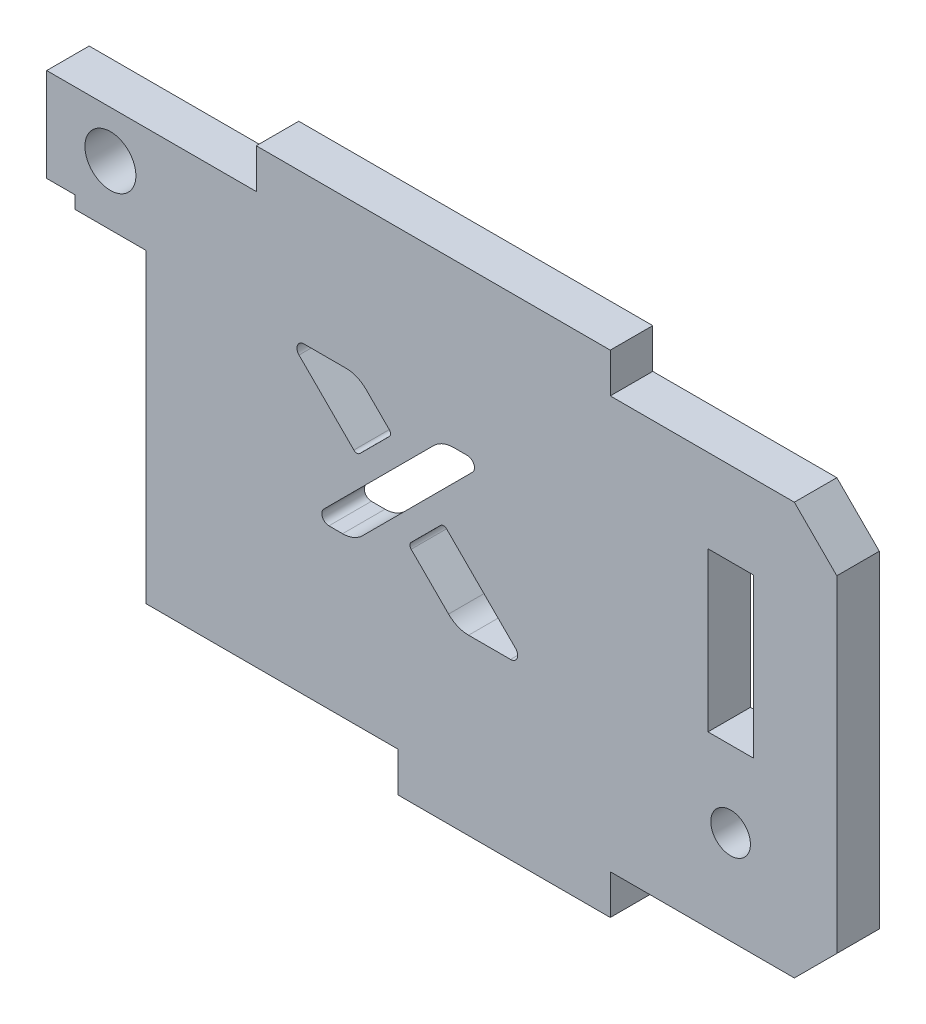
from build123d import *

# Parameters (mm, degrees)
SKETCH_1_R           = 1.8
SKETCH_1_W           = 3
SKETCH_1_H           = 12
EXTRUDE_1_DEPTH      = 3
SKETCH_3_W           = 34
SKETCH_3_H           = 3
CUT_EXTRUDE_1_DEPTH  = 10
SKETCH_4_W           = 38
SKETCH_4_H           = 2
CUT_EXTRUDE_2_DEPTH  = 10
SKETCH_5_W           = 3
SKETCH_5_H           = 2
EXTRUDE_2_DEPTH      = 2
SKETCH_6_W           = 3
SKETCH_6_H           = 2
EXTRUDE_3_DEPTH      = 2
SKETCH_7_W           = 34
SKETCH_7_H           = 3
CUT_EXTRUDE_3_DEPTH  = 2
SKETCH_8_W           = 3
SKETCH_8_H           = 10
EXTRUDE_4_DEPTH      = 5
SKETCH_9_W           = 5
SKETCH_9_H           = 3
CUT_EXTRUDE_4_DEPTH  = 2
CUT_EXTRUDE_5_DEPTH  = 10
SKETCH_11_W          = 3
SKETCH_11_H          = 8
CUT_EXTRUDE_6_DEPTH  = 5
SKETCH_12_W          = 3.2
SKETCH_12_H          = 12.2
SKETCH_12_W_2        = 3
SKETCH_12_H_2        = 12
CUT_EXTRUDE_7_DEPTH  = 10
SKETCH_13_W          = 3.2
SKETCH_13_H          = 3
EXTRUDE_5_DEPTH      = 3
SKETCH_14_W          = 3.2
SKETCH_14_H          = 3
CUT_EXTRUDE_8_DEPTH  = 3
SKETCH_15_W          = 3.2
SKETCH_15_H          = 3
EXTRUDE_6_DEPTH      = 1
SKETCH_16_R          = 1.4
CUT_EXTRUDE_9_DEPTH  = 3
SKETCH_17_W          = 5
SKETCH_17_H          = 3.106186253
CUT_EXTRUDE_10_DEPTH = 10


with BuildPart() as part:
    # 草图1 → 凸台-拉伸1 (new body)
    with BuildSketch(Plane.XY):
        Polygon((-64.8, 13.92), (-67.8, 13.92), (-70.8, 10.92), (-70.8, -12.18), (-67.8, -15.18), (-64.8, -15.18), (-54.8, -15.18), (-54.8, -17.98), (-39.8, -17.98), (-39.8, -15.18), (-22, -15.18), (-22, 3.32), (-17, 3.32), (-17, 0.32), (17, 0.32), (17, 3.32), (22, 3.32), (22, -15.18), (39.8, -15.18), (39.8, -17.98), (54.8, -17.98), (54.8, -15.18), (67.8, -15.18), (70.8, -12.18), (70.8, 10.92), (67.8, 13.92), (54.8, 13.92), (54.8, 16.72), (29.8, 16.72), (29.8, 13.92), (10, 13.92), (10, 16.72), (-10, 16.72), (-10, 13.92), (-29.8, 13.92), (-29.8, 16.72), (-54.8, 16.72), (-54.8, 13.92), align=None)
        with Locations((-19.5, 10.636938849)):
            Circle(SKETCH_1_R, mode=Mode.SUBTRACT)
        with Locations((19.5, 10.636938849)):
            Circle(SKETCH_1_R, mode=Mode.SUBTRACT)
        with BuildLine():
            Line((-48.112743691, -4.863700543), (-43.239089288, 0.009953861))
            ThreePointArc((-43.239089288, 0.009953861), (-43.026957254, 0.097821826), (-42.814825219, 0.009953861))
            Line((-42.814825219, 0.009953861), (-40.739089288, -2.065782071))
            ThreePointArc((-40.739089288, -2.065782071), (-40.651221322, -2.277914105), (-40.739089288, -2.490046139))
            Line((-40.739089288, -2.490046139), (-43.380510644, -5.131467496))
            ThreePointArc((-43.380510644, -5.131467496), (-44.029357342, -5.565012998), (-44.794724207, -5.717253933))
            Line((-44.794724207, -5.717253933), (-47.759190301, -5.717253933))
            ThreePointArc((-47.759190301, -5.717253933), (-48.221130067, -5.408595649), (-48.112743691, -4.863700543))
        make_face(mode=Mode.SUBTRACT)
        with Locations((-63.3, -0.08)):
            Rectangle(SKETCH_1_W, SKETCH_1_H, mode=Mode.SUBTRACT)
        with BuildLine():
            Line((-37.309442832, -3.374108183), (-45.06249116, 4.378940145))
            ThreePointArc((-45.06249116, 4.378940145), (-45.170877535, 4.923835251), (-44.708937769, 5.232493535))
            Line((-44.708937769, 5.232493535), (-43.744471675, 5.232493535))
            ThreePointArc((-43.744471675, 5.232493535), (-42.97910481, 5.0802526), (-42.330258113, 4.646707097))
            Line((-42.330258113, 4.646707097), (-34.577209785, -3.10634123))
            ThreePointArc((-34.577209785, -3.10634123), (-34.46882341, -3.651236336), (-34.930763176, -3.95989462))
            Line((-34.930763176, -3.95989462), (-35.89522927, -3.95989462))
            ThreePointArc((-35.89522927, -3.95989462), (-36.660596135, -3.807653685), (-37.309442832, -3.374108183))
        make_face(mode=Mode.SUBTRACT)
        with BuildLine():
            Line((-32.819850472, 5.429192676), (-36.693504876, 1.555538273))
            ThreePointArc((-36.693504876, 1.555538273), (-36.90563691, 1.467670307), (-37.117768944, 1.555538273))
            Line((-37.117768944, 1.555538273), (-39.193504876, 3.631274204))
            ThreePointArc((-39.193504876, 3.631274204), (-39.281372841, 3.843406239), (-39.193504876, 4.055538273))
            Line((-39.193504876, 4.055538273), (-37.55208352, 5.696959629))
            ThreePointArc((-37.55208352, 5.696959629), (-36.903236822, 6.130505132), (-36.137869957, 6.282746067))
            Line((-36.137869957, 6.282746067), (-33.173403863, 6.282746067))
            ThreePointArc((-33.173403863, 6.282746067), (-32.711464097, 5.974087783), (-32.819850472, 5.429192676))
        make_face(mode=Mode.SUBTRACT)
        with Locations((63.3, -0.076886306)):
            Rectangle(SKETCH_1_W, SKETCH_1_H, mode=Mode.SUBTRACT)
        with BuildLine():
            Line((42.330258113, 4.646707097), (34.577209785, -3.10634123))
            ThreePointArc((34.577209785, -3.10634123), (34.46882341, -3.651236336), (34.930763176, -3.95989462))
            Line((34.930763176, -3.95989462), (35.89522927, -3.95989462))
            ThreePointArc((35.89522927, -3.95989462), (36.660596135, -3.807653685), (37.309442832, -3.374108183))
            Line((37.309442832, -3.374108183), (45.06249116, 4.378940145))
            ThreePointArc((45.06249116, 4.378940145), (45.170877535, 4.923835251), (44.708937769, 5.232493535))
            Line((44.708937769, 5.232493535), (43.744471675, 5.232493535))
            ThreePointArc((43.744471675, 5.232493535), (42.97910481, 5.0802526), (42.330258113, 4.646707097))
        make_face(mode=Mode.SUBTRACT)
        with BuildLine():
            Line((48.112743691, -4.863700543), (43.239089288, 0.009953861))
            ThreePointArc((43.239089288, 0.009953861), (43.026957254, 0.097821826), (42.814825219, 0.009953861))
            Line((42.814825219, 0.009953861), (40.739089288, -2.065782071))
            ThreePointArc((40.739089288, -2.065782071), (40.651221322, -2.277914105), (40.739089288, -2.490046139))
            Line((40.739089288, -2.490046139), (43.380510644, -5.131467496))
            ThreePointArc((43.380510644, -5.131467496), (44.029357342, -5.565012998), (44.794724207, -5.717253933))
            Line((44.794724207, -5.717253933), (47.759190301, -5.717253933))
            ThreePointArc((47.759190301, -5.717253933), (48.221130067, -5.408595649), (48.112743691, -4.863700543))
        make_face(mode=Mode.SUBTRACT)
        with BuildLine():
            Line((39.193504876, 4.055538273), (37.55208352, 5.696959629))
            ThreePointArc((37.55208352, 5.696959629), (36.903236822, 6.130505132), (36.137869957, 6.282746067))
            Line((36.137869957, 6.282746067), (33.173403863, 6.282746067))
            ThreePointArc((33.173403863, 6.282746067), (32.711464097, 5.974087783), (32.819850472, 5.429192676))
            Line((32.819850472, 5.429192676), (36.693504876, 1.555538273))
            ThreePointArc((36.693504876, 1.555538273), (36.90563691, 1.467670307), (37.117768944, 1.555538273))
            Line((37.117768944, 1.555538273), (39.193504876, 3.631274204))
            ThreePointArc((39.193504876, 3.631274204), (39.281372841, 3.843406239), (39.193504876, 4.055538273))
        make_face(mode=Mode.SUBTRACT)
    extrude(amount=EXTRUDE_1_DEPTH)

    # 草图3 → 切除-拉伸1 (cut)
    with BuildSketch(Plane(origin=(0, 0, 0), x_dir=(-1, 0, 0), z_dir=(0, 0, -1))):
        with Locations((0, 1.82)):
            Rectangle(SKETCH_3_W, SKETCH_3_H)
    extrude(amount=-CUT_EXTRUDE_1_DEPTH, mode=Mode.SUBTRACT)

    # 草图4 → 切除-拉伸2 (cut)
    with BuildSketch(Plane(origin=(0, 0, 0), x_dir=(-1, 0, 0), z_dir=(0, 0, -1))):
        with Locations((0, 4.32)):
            Rectangle(SKETCH_4_W, SKETCH_4_H)
    extrude(amount=-CUT_EXTRUDE_2_DEPTH, mode=Mode.SUBTRACT)

    # 草图5 → 凸台-拉伸2 (add)
    with BuildSketch(Plane(origin=(-19, 0, 0), x_dir=(0, 0, -1), z_dir=(1, 0, 0))):
        with Locations((-1.5, 4.32)):
            Rectangle(SKETCH_5_W, SKETCH_5_H)
    extrude(amount=EXTRUDE_2_DEPTH)

    # 草图6 → 凸台-拉伸3 (add)
    with BuildSketch(Plane.ZY.offset(-19)):
        with Locations((1.5, 4.32)):
            Rectangle(SKETCH_6_W, SKETCH_6_H)
    extrude(amount=EXTRUDE_3_DEPTH)

    # 草图7 → 切除-拉伸3 (cut)
    with BuildSketch(Plane.XZ.offset(-5.32)):
        with Locations((0, 1.5)):
            Rectangle(SKETCH_7_W, SKETCH_7_H)
    extrude(amount=-CUT_EXTRUDE_3_DEPTH, mode=Mode.SUBTRACT)

    # 草图8 → 凸台-拉伸4 (add)
    with BuildSketch(Plane.ZY.offset(-22)):
        with Locations((1.5, -7.18)):
            Rectangle(SKETCH_8_W, SKETCH_8_H)
    extrude_4 = extrude(amount=EXTRUDE_4_DEPTH)

    # 镜向1: 凸台-拉伸4 across plane
    add(extrude_4.mirror(Plane.ZY))

    # 草图9 → 切除-拉伸4 (cut)
    with BuildSketch(Plane.XZ.offset(12.18)):
        with Locations((-19.5, 1.5)):
            Rectangle(SKETCH_9_W, SKETCH_9_H)
        with Locations((19.5, 1.5)):
            Rectangle(SKETCH_9_W, SKETCH_9_H)
    extrude(amount=-CUT_EXTRUDE_4_DEPTH, mode=Mode.SUBTRACT)

    # 草图10 → 切除-拉伸5 (cut)
    with BuildSketch(Plane(origin=(0, 0, 0), x_dir=(-1, 0, 0), z_dir=(0, 0, -1))):
        Polygon((-15, 7.32), (-15, 18.727392341), (81.723481171, 18.727392341), (81.723481171, -24.797051458), (-15, -24.797051458), align=None)
    extrude(amount=-CUT_EXTRUDE_5_DEPTH, mode=Mode.SUBTRACT)

    # 草图11 → 切除-拉伸6 (cut)
    with BuildSketch(Plane.ZY.offset(-17)):
        with Locations((1.5, -6.18)):
            Rectangle(SKETCH_11_W, SKETCH_11_H)
    extrude(amount=-CUT_EXTRUDE_6_DEPTH, mode=Mode.SUBTRACT)

    # 草图12 → 切除-拉伸7 (cut)
    with BuildSketch(Plane(origin=(0, 0, 0), x_dir=(-1, 0, 0), z_dir=(0, 0, -1))):
        with Locations((-63.3, -0.076886306)):
            Rectangle(SKETCH_12_W, SKETCH_12_H)
        with Locations((-63.3, -0.076886306)):
            Rectangle(SKETCH_12_W_2, SKETCH_12_H_2, mode=Mode.SUBTRACT)
    extrude(amount=-CUT_EXTRUDE_7_DEPTH, mode=Mode.SUBTRACT)

    # 草图13 → 凸台-拉伸5 (add)
    with BuildSketch(Plane(origin=(0, -6.176886306, 0), x_dir=(1, 0, 0), z_dir=(0, 1, 0))):
        with Locations((63.3, -1.5)):
            Rectangle(SKETCH_13_W, SKETCH_13_H)
    extrude(amount=EXTRUDE_5_DEPTH)

    # 草图14 → 切除-拉伸8 (cut)
    with BuildSketch(Plane.XZ.offset(-6.023113694)):
        with Locations((63.3, 1.5)):
            Rectangle(SKETCH_14_W, SKETCH_14_H)
    extrude(amount=-CUT_EXTRUDE_8_DEPTH, mode=Mode.SUBTRACT)

    # 草图15 → 凸台-拉伸6 (add)
    with BuildSketch(Plane.XZ.offset(-9.023113694)):
        with Locations((63.3, 1.5)):
            Rectangle(SKETCH_15_W, SKETCH_15_H)
    extrude(amount=EXTRUDE_6_DEPTH)

    # 草图16 → 切除-拉伸9 (cut)
    with BuildSketch(Plane(origin=(-133.943153128, 43.327317851, 0), x_dir=(-1, 0, 0), z_dir=(0, 0, -1))):
        with Locations((-197.243153128, -51.882049417)):
            Circle(SKETCH_16_R)
    extrude(amount=-CUT_EXTRUDE_9_DEPTH, mode=Mode.SUBTRACT)

    # 草图17 → 切除-拉伸10 (cut)
    with BuildSketch(Plane(origin=(-133.943153128, 43.327317851, 0), x_dir=(-1, 0, 0), z_dir=(0, 0, -1))):
        with Locations((-153.443153128, -38.454224725)):
            Rectangle(SKETCH_17_W, SKETCH_17_H)
    extrude(amount=-CUT_EXTRUDE_10_DEPTH, mode=Mode.SUBTRACT)


solid = part.part
